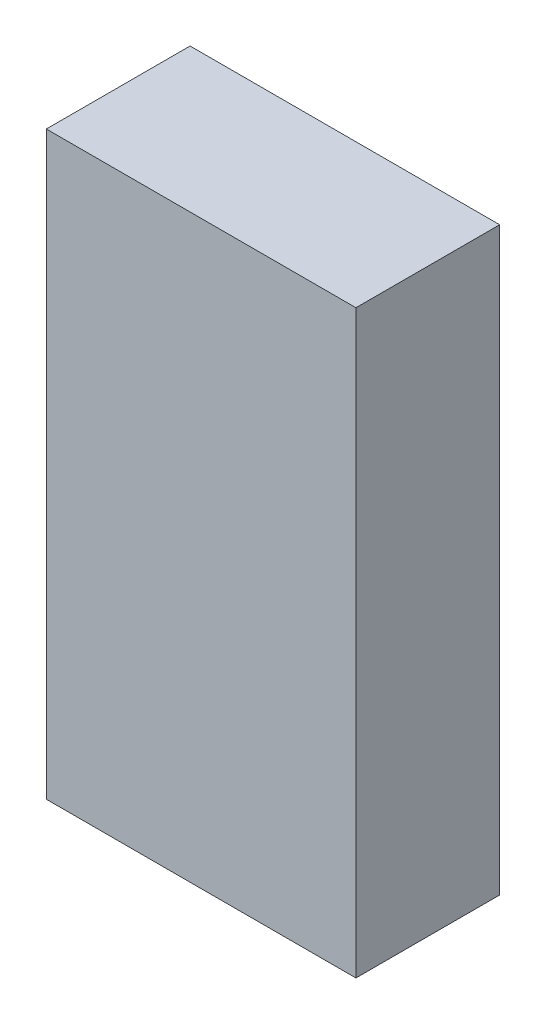
from build123d import *

# Parameters (mm, degrees)
SKETCH1_W           = 112
SKETCH1_H           = 210
BOSS_EXTRUDE1_DEPTH = 52


with BuildPart() as part:
    # Sketch1 → Boss-Extrude1 (new body)
    with BuildSketch(Plane.XY):
        Rectangle(SKETCH1_W, SKETCH1_H)
    extrude(amount=BOSS_EXTRUDE1_DEPTH)


solid = part.part
